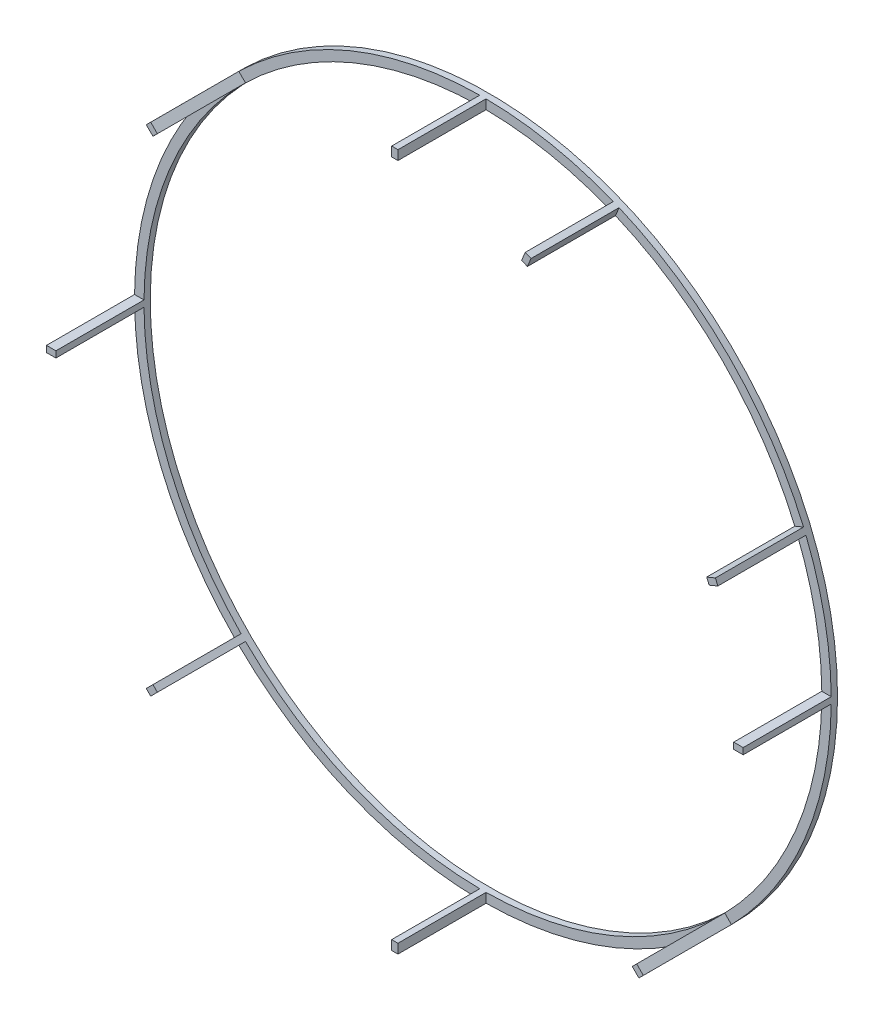
from build123d import *
from build123d.topology import SkipClean

# Parameters (mm, degrees)
SKETCH1_R           = 110.731806219
SKETCH1_R_2         = 107.731806219
BOSS_EXTRUDE1_DEPTH = 2
BOSS_EXTRUDE3_DEPTH = 30


with BuildPart() as part:
    # Sketch1 → Boss-Extrude1 (new body)
    with BuildSketch(Plane.XY):
        Circle(SKETCH1_R)
        Circle(SKETCH1_R_2, mode=Mode.SUBTRACT)
    extrude(amount=BOSS_EXTRUDE1_DEPTH)

    # Sketch3 → Boss-Extrude3 (add)
    with SkipClean():  # the faces are left unmerged after this step: merging them gives an invalid solid
        with BuildSketch(Plane.XY):
            with BuildLine():
                Line((1, 107.727164964), (1, 110.727290712))
                ThreePointArc((1, 110.727290712), (0, 110.731806219), (-1, 110.727290712))
                Line((-1, 110.727290712), (-1, 107.727164964))
                ThreePointArc((-1, 107.727164964), (0, 107.731806219), (1, 107.727164964))
            make_face()
            with BuildLine():
                Line((107.727164964, 1), (110.727290712, 1))
                ThreePointArc((110.727290712, 1), (110.731806219, 0), (110.727290712, -1))
                Line((110.727290712, -1), (107.727164964, -1))
                ThreePointArc((107.727164964, -1), (107.731806219, 0), (107.727164964, 1))
            make_face()
            with BuildLine():
                Line((76.881715645, -75.467502083), (79.003124906, -77.588911344))
                ThreePointArc((79.003124906, -77.588911344), (78.29921107, -78.29921107), (77.588911344, -79.003124906))
                Line((77.588911344, -79.003124906), (75.467502083, -76.881715645))
                ThreePointArc((75.467502083, -76.881715645), (76.177890727, -76.177890727), (76.881715645, -75.467502083))
            make_face()
            with BuildLine():
                Line((1, -107.727164964), (1, -110.727290712))
                ThreePointArc((1, -110.727290712), (0, -110.731806219), (-1, -110.727290712))
                Line((-1, -110.727290712), (-1, -107.727164964))
                ThreePointArc((-1, -107.727164964), (0, -107.731806219), (1, -107.727164964))
            make_face()
            with BuildLine():
                Line((-75.467502083, -76.881715645), (-77.588911344, -79.003124906))
                ThreePointArc((-77.588911344, -79.003124906), (-78.29921107, -78.29921107), (-79.003124906, -77.588911344))
                Line((-79.003124906, -77.588911344), (-76.881715645, -75.467502083))
                ThreePointArc((-76.881715645, -75.467502083), (-76.177890727, -76.177890727), (-75.467502083, -76.881715645))
            make_face()
            with BuildLine():
                Line((-107.727164964, -1), (-110.727290712, -1))
                ThreePointArc((-110.727290712, -1), (-110.731806219, 0), (-110.727290712, 1))
                Line((-110.727290712, 1), (-107.727164964, 1))
                ThreePointArc((-107.727164964, 1), (-107.731806219, 0), (-107.727164964, -1))
            make_face()
            with BuildLine():
                Line((-76.881715645, 75.467502083), (-79.003124906, 77.588911344))
                ThreePointArc((-79.003124906, 77.588911344), (-78.29921107, 78.29921107), (-77.588911344, 79.003124906))
                Line((-77.588911344, 79.003124906), (-75.467502083, 76.881715645))
                ThreePointArc((-75.467502083, 76.881715645), (-76.177890727, 76.177890727), (-76.881715645, 75.467502083))
            make_face()
            with BuildLine():
                Line((99.144239373, 42.14928078), (101.915994147, 43.297379199))
                ThreePointArc((101.915994147, 43.297379199), (102.302849363, 42.375227676), (102.681361012, 41.449620134))
                Line((102.681361012, 41.449620134), (99.909606238, 40.301521715))
                ThreePointArc((99.909606238, 40.301521715), (99.531210766, 41.227177379), (99.144239373, 42.14928078))
            make_face()
            with BuildLine():
                Line((40.301521715, 99.909606238), (41.449620134, 102.681361012))
                ThreePointArc((41.449620134, 102.681361012), (42.375227676, 102.302849363), (43.297379199, 101.915994147))
                Line((43.297379199, 101.915994147), (42.14928078, 99.144239373))
                ThreePointArc((42.14928078, 99.144239373), (41.227177379, 99.531210766), (40.301521715, 99.909606238))
            make_face()
        extrude(amount=BOSS_EXTRUDE3_DEPTH)


solid = part.part
